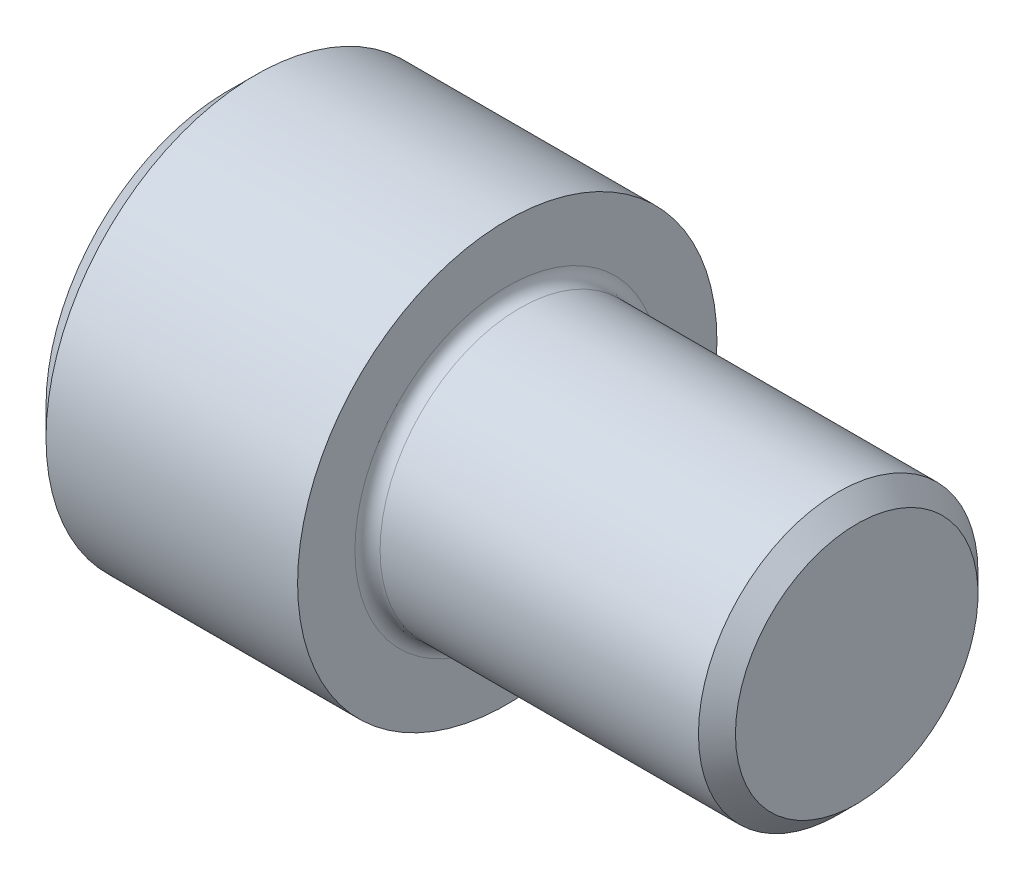
from build123d import *

# Parameters (mm, degrees)
FILLET1_R   = 2.286
HEX_2_DEPTH = 25.273


with BuildPart() as part:
    # BodySke → Base-Revolve (revolve)
    with BuildSketch(Plane.XY, mode=Mode.PRIVATE) as base_revolve_sk:
        Polygon((0, 0), (0, 33.02), (5.08, 38.1), (50.8, 38.1), (50.8, 25.4), (110.93831, 25.4), (114.3, 22.03831), (114.3, 0), align=None)
    revolve(base_revolve_sk.sketch.rotate(Axis((-31.75, 0, 0), (1, 0, 0)), 90), axis=Axis((-31.75, 0, 0), (1, 0, 0)))

    # Fillet1
    fillet1_edges = [part.edges().sort_by_distance(p)[0] for p in [
        (50.8, 0, -25.4),
    ]]
    fillet(fillet1_edges, radius=FILLET1_R)

    # Sketch2 → Hex-PreBroach (revolve, cut)
    with BuildSketch(Plane.XY, mode=Mode.PRIVATE) as hex_prebroach_sk:
        Polygon((0, 19.05), (25.273, 19.05), (36.271522628, 0), (0, 0), align=None)
    revolve(hex_prebroach_sk.sketch.rotate(Axis((0, 0, 0), (1, 0, 0)), 90), axis=Axis((0, 0, 0), (1, 0, 0)), mode=Mode.SUBTRACT)

    # Sketch3 → Hex 2 (cut)
    with BuildSketch(Plane(origin=(0, 0, 0), x_dir=(0, 0.500000000000001, 0.866025403784438), z_dir=(-1, 0, 0))):
        Polygon((10.998522628, 19.05), (-10.998522628, 19.05), (-21.997045256, 0), (-10.998522628, -19.05), (10.998522628, -19.05), (21.997045256, 0), align=None)
    extrude(amount=-HEX_2_DEPTH, mode=Mode.SUBTRACT)


solid = part.part
